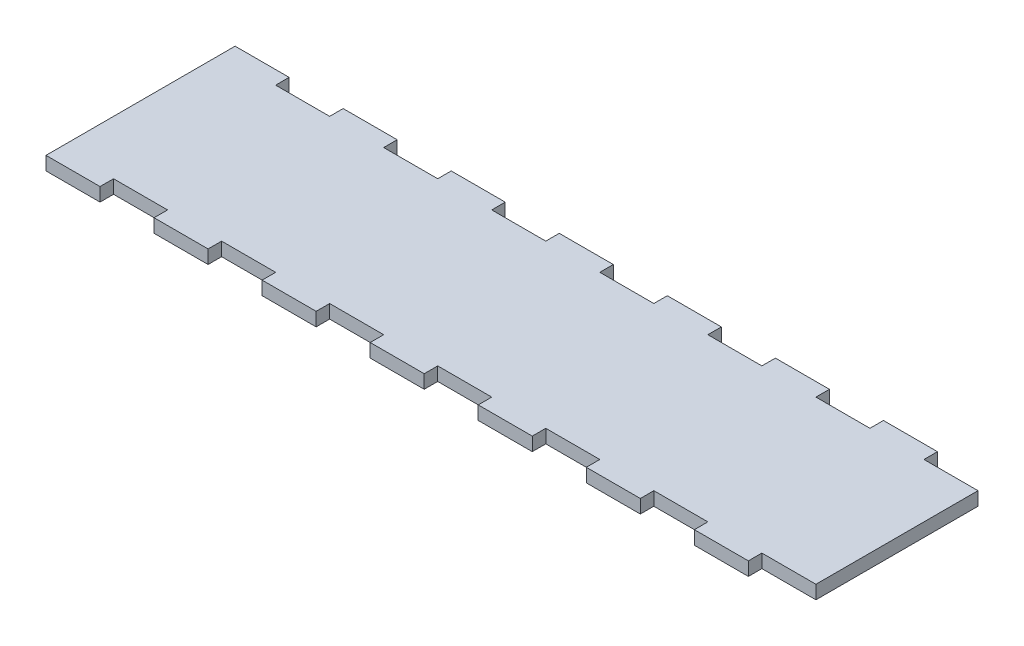
from build123d import *

# Parameters (mm, degrees)
BOSS_EXTRUDE1_DEPTH = 3.175


with BuildPart() as part:
    # Sketch1 → Boss-Extrude1 (new body)
    with BuildSketch(Plane(origin=(0, 0, 0), x_dir=(1, 0, 0), z_dir=(0, 1, 0))):
        Polygon((0, 0), (0, -44.45), (12.7, -44.45), (12.7, -41.275), (25.4, -41.275), (25.4, -44.45), (38.1, -44.45), (38.1, -41.275), (50.8, -41.275), (50.8, -44.45), (63.5, -44.45), (63.5, -41.275), (76.2, -41.275), (76.2, -44.45), (88.9, -44.45), (88.9, -41.275), (101.6, -41.275), (101.6, -44.45), (114.3, -44.45), (114.3, -41.275), (127, -41.275), (127, -44.45), (139.7, -44.45), (139.7, -41.275), (152.4, -41.275), (152.4, -44.45), (165.1, -44.45), (165.1, -41.275), (177.8, -41.275), (177.8, -3.175), (165.1, -3.175), (165.1, 0), (152.4, 0), (152.4, -3.175), (139.7, -3.175), (139.7, 0), (127, 0), (127, -3.175), (114.3, -3.175), (114.3, 0), (101.6, 0), (101.6, -3.175), (88.9, -3.175), (88.9, 0), (76.2, 0), (76.2, -3.175), (63.5, -3.175), (63.5, 0), (50.8, 0), (50.8, -3.175), (38.1, -3.175), (38.1, 0), (25.4, 0), (25.4, -3.175), (12.7, -3.175), (12.7, 0), align=None)
    extrude(amount=BOSS_EXTRUDE1_DEPTH)


solid = part.part
